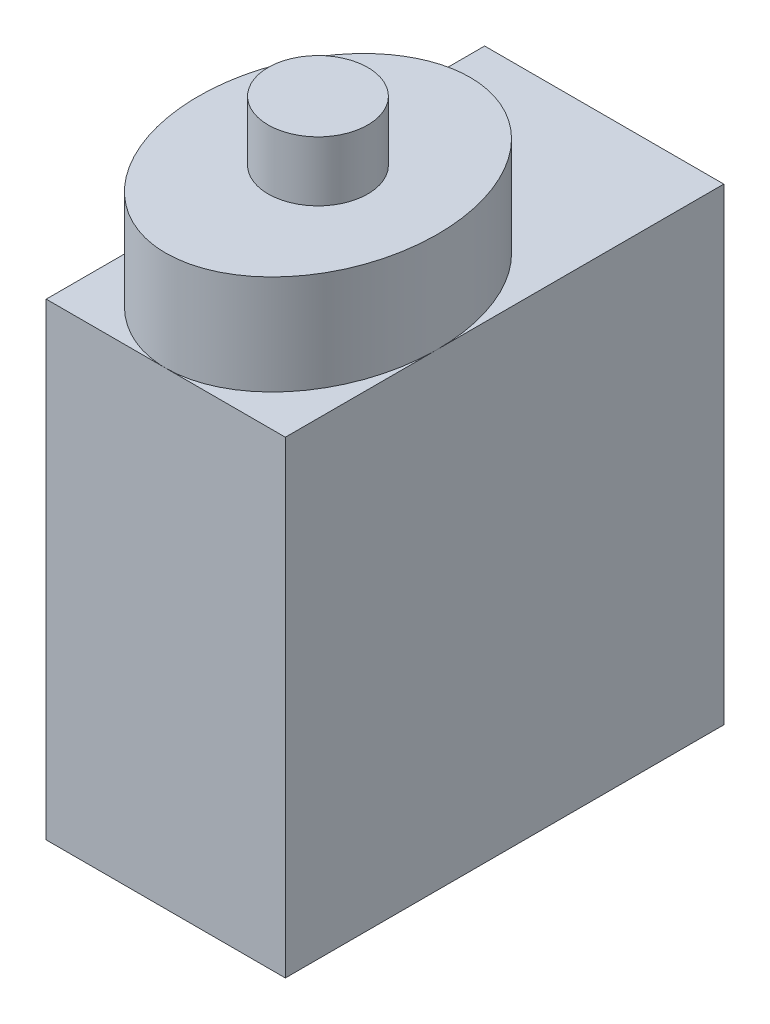
from build123d import *

# Parameters (mm, degrees)
SKETCH_1_W          = 12
SKETCH_1_H          = 22
EXTRUDE_1_DEPTH     = 16
SKETCH_2_W          = 12
SKETCH_2_H          = 32
EXTRUDE_2_DEPTH     = 2.5
SKETCH_4_W          = 12
SKETCH_4_H          = 22
EXTRUDE_4_DEPTH     = 5
SKETCH_5_RX         = 7.637200615
SKETCH_5_RY         = 6
EXTRUDE_5_DEPTH     = 5
SKETCH_6_R          = 2.5
EXTRUDE_6_DEPTH     = 3
SKETCH_7_W          = 5
SKETCH_7_H          = 2.5
CUT_EXTRUDE_1_DEPTH = 38.312866414


with BuildPart() as part:
    # 草图1 → 凸台-拉伸1 (new body)
    with BuildSketch(Plane(origin=(0, 0, 0), x_dir=(1, 0, 0), z_dir=(0, 1, 0))):
        Rectangle(SKETCH_1_W, SKETCH_1_H)
    extrude(amount=EXTRUDE_1_DEPTH)

    # 草图2 → 凸台-拉伸2 (add)
    with BuildSketch(Plane(origin=(0, 16, 0), x_dir=(1, 0, 0), z_dir=(0, 1, 0))):
        Rectangle(SKETCH_2_W, SKETCH_2_H)
    extrude(amount=EXTRUDE_2_DEPTH)

    # 草图4 → 凸台-拉伸4 (add)
    with BuildSketch(Plane(origin=(0, 18.5, 0), x_dir=(1, 0, 0), z_dir=(0, 1, 0))):
        Rectangle(SKETCH_4_W, SKETCH_4_H)
    extrude(amount=EXTRUDE_4_DEPTH)

    # 草图5 → 凸台-拉伸5 (add)
    with BuildSketch(Plane(origin=(0, 23.5, 0), x_dir=(1, 0, 0), z_dir=(0, 1, 0))):
        with Locations(Location((0, -3.362799385), (0, 0, -90))):
            Ellipse(SKETCH_5_RX, SKETCH_5_RY)
    extrude(amount=EXTRUDE_5_DEPTH)

    # 草图6 → 凸台-拉伸6 (add)
    with BuildSketch(Plane(origin=(0, 28.5, 0), x_dir=(1, 0, 0), z_dir=(0, 1, 0))):
        with Locations(Location((0, -3.362799385, 0), (0, 0, 270))):
            Circle(SKETCH_6_R)
    extrude(amount=EXTRUDE_6_DEPTH)

    # 草图7 → 切除-拉伸1 (cut, through all)
    with BuildSketch(Plane.ZY.offset(6)):
        with Locations((-13.5, 17.25)):
            Rectangle(SKETCH_7_W, SKETCH_7_H)
        with Locations((13.5, 17.25)):
            Rectangle(SKETCH_7_W, SKETCH_7_H)
    extrude(amount=-CUT_EXTRUDE_1_DEPTH, mode=Mode.SUBTRACT)


solid = part.part
